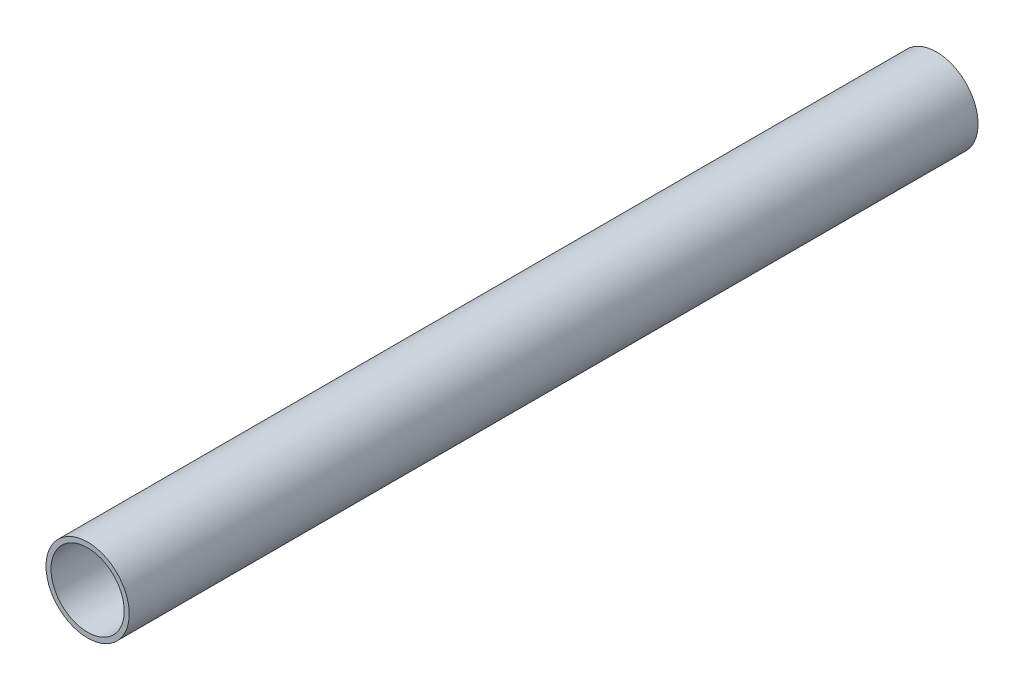
from build123d import *

# Parameters (mm, degrees)
SKETCH_1_R          = 12.5
EXTRUDE_2_DEPTH     = 235.43
SKETCH_2_R          = 9
CUT_EXTRUDE_1_DEPTH = 235.43
EXTRUDE_START       = 15.57
SKETCH_3_R          = 12.5
EXTRUDE_3_DEPTH     = 15.57
SKETCH_4_R          = 9
CUT_EXTRUDE_2_DEPTH = 20
EXTRUDE_START_2     = 9.93
SKETCH_5_R          = 12.5
EXTRUDE_4_DEPTH     = 9.93
SKETCH_6_R          = 9
CUT_EXTRUDE_3_DEPTH = 10
SKETCH_7_R          = 26.85848727
CUT_EXTRUDE_4_DEPTH = 14.93
SKETCH_8_R          = 12.5
EXTRUDE_5_DEPTH     = 9.93
SKETCH_9_R          = 9
CUT_EXTRUDE_5_DEPTH = 10
SKETCH_10_R         = 37.193394561
CUT_EXTRUDE_6_DEPTH = 0.22
SKETCH_11_R         = 43.187188263
CUT_EXTRUDE_7_DEPTH = 0.71
SKETCH_12_R         = 11
CUT_EXTRUDE_8_DEPTH = 338


with BuildPart() as part:
    # 草图1 → 凸台-拉伸2 (new body)
    with BuildSketch(Plane.XY):
        Circle(SKETCH_1_R)
    extrude(amount=EXTRUDE_2_DEPTH)

    # 草图2 → 切除-拉伸1 (cut)
    with BuildSketch(Plane(origin=(0, 0, 0), x_dir=(-1, 0, 0), z_dir=(0, 0, -1))):
        Circle(SKETCH_2_R)
    extrude(amount=-CUT_EXTRUDE_1_DEPTH, mode=Mode.SUBTRACT)

    # 草图3 → 凸台-拉伸3 (add)
    with BuildSketch(Plane(origin=(0, 0, 0), x_dir=(-1, 0, 0), z_dir=(0, 0, -1)).offset(EXTRUDE_START)):
        Circle(SKETCH_3_R)
    extrude(amount=-EXTRUDE_3_DEPTH)

    # 草图4 → 切除-拉伸2 (cut)
    with BuildSketch(Plane(origin=(0, 0, -15.57), x_dir=(-1, 0, 0), z_dir=(0, 0, -1))):
        Circle(SKETCH_4_R)
    extrude(amount=-CUT_EXTRUDE_2_DEPTH, mode=Mode.SUBTRACT)

    # 草图5 → 凸台-拉伸4 (add)
    with BuildSketch(Plane(origin=(0, 0, -15.57), x_dir=(-1, 0, 0), z_dir=(0, 0, -1)).offset(EXTRUDE_START_2)):
        Circle(SKETCH_5_R)
    extrude(amount=-EXTRUDE_4_DEPTH)

    # 草图6 → 切除-拉伸3 (cut)
    with BuildSketch(Plane(origin=(0, 0, -25.5), x_dir=(-1, 0, 0), z_dir=(0, 0, -1))):
        Circle(SKETCH_6_R)
    extrude(amount=-CUT_EXTRUDE_3_DEPTH, mode=Mode.SUBTRACT)

    # 草图7 → 切除-拉伸4 (cut)
    with BuildSketch(Plane(origin=(0, 0, -25.5), x_dir=(-1, 0, 0), z_dir=(0, 0, -1))):
        Circle(SKETCH_7_R)
    extrude(amount=-CUT_EXTRUDE_4_DEPTH, mode=Mode.SUBTRACT)

    # 草图8 → 凸台-拉伸5 (add)
    with BuildSketch(Plane(origin=(0, 0, -10.57), x_dir=(-1, 0, 0), z_dir=(0, 0, -1)).offset(EXTRUDE_START_2)):
        Circle(SKETCH_8_R)
    extrude(amount=-EXTRUDE_5_DEPTH)

    # 草图9 → 切除-拉伸5 (cut)
    with BuildSketch(Plane(origin=(0, 0, -20.5), x_dir=(-1, 0, 0), z_dir=(0, 0, -1))):
        Circle(SKETCH_9_R)
    extrude(amount=-CUT_EXTRUDE_5_DEPTH, mode=Mode.SUBTRACT)

    # 草图10 → 切除-拉伸6 (cut)
    with BuildSketch(Plane(origin=(0, 0, -20.5), x_dir=(-1, 0, 0), z_dir=(0, 0, -1))):
        with Locations((7.201744855, 7.507888779)):
            Circle(SKETCH_10_R)
    extrude(amount=-CUT_EXTRUDE_6_DEPTH, mode=Mode.SUBTRACT)

    # 草图11 → 切除-拉伸7 (cut)
    with BuildSketch(Plane(origin=(0, 0, -20.28), x_dir=(-1, 0, 0), z_dir=(0, 0, -1))):
        with Locations((-1.225460352, 2.329416421)):
            Circle(SKETCH_11_R)
    extrude(amount=-CUT_EXTRUDE_7_DEPTH, mode=Mode.SUBTRACT)

    # 草图12 → 切除-拉伸8 (cut)
    with BuildSketch(Plane(origin=(0, 0, -19.57), x_dir=(-1, 0, 0), z_dir=(0, 0, -1))):
        Circle(SKETCH_12_R)
    extrude(amount=-CUT_EXTRUDE_8_DEPTH, mode=Mode.SUBTRACT)


solid = part.part
